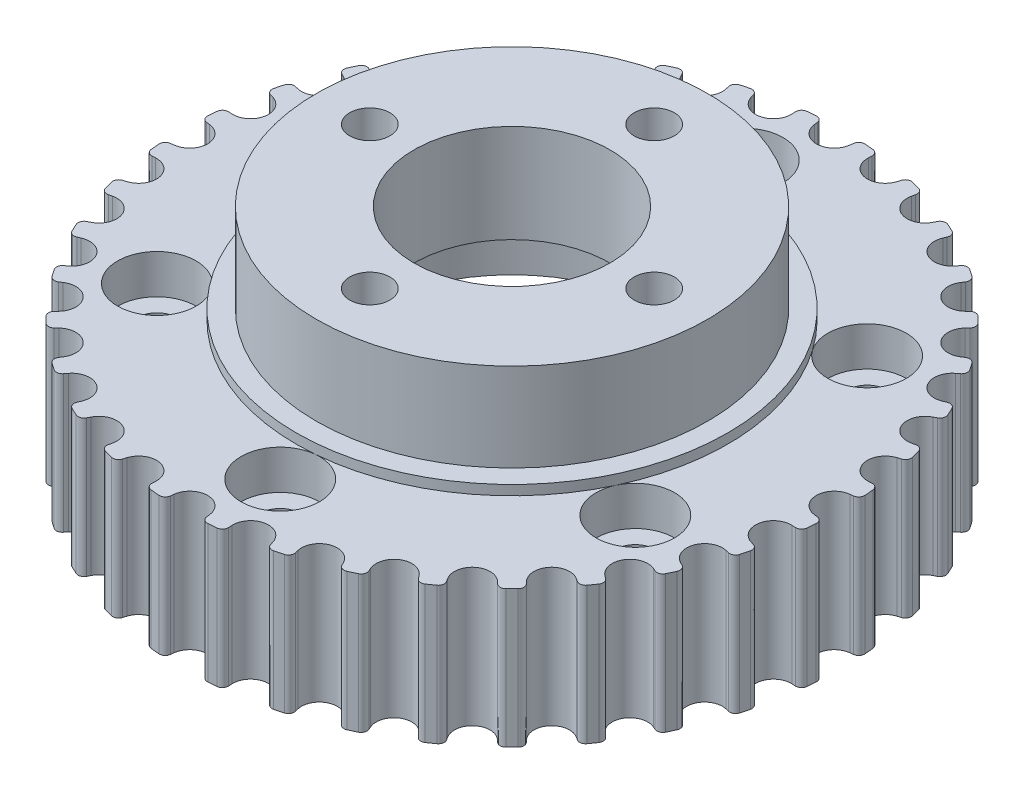
from build123d import *

# Parameters (mm, degrees)
SKETCH_1_R               = 16.8
EXTRUDE_1_DEPTH          = 3.5
CUT_EXTRUDE_1_DEPTH      = 50
PATTERN_CIRCULAR_1_COUNT = 36
SKETCH_4_R               = 7.75
CUT_EXTRUDE_2_DEPTH      = 50
SKETCH_11_R              = 9
CUT_EXTRUDE_9_DEPTH      = 3.5
SKETCH_14_R              = 9.975
SKETCH_14_R_2            = 5
EXTRUDE_3_DEPTH          = 5
SKETCH_15_R              = 1.025
CUT_EXTRUDE_10_DEPTH     = 4
SKETCH_16_R              = 14.5
CUT_EXTRUDE_12_DEPTH     = 3.5
SKETCH_17_R              = 1
CUT_EXTRUDE_13_DEPTH     = 10
SKETCH_20_R              = 2
CUT_EXTRUDE_15_DEPTH     = 2
SKETCH_21_R              = 11
SKETCH_21_R_2            = 9.975
EXTRUDE_4_DEPTH          = 0.5


with BuildPart() as part:
    # 草图1 → 凸台-拉伸1 (new, symmetric)
    with BuildSketch(Plane(origin=(0, 0, 0), x_dir=(1, 0, 0), z_dir=(0, 1, 0))):
        Circle(SKETCH_1_R)
    extrude(amount=EXTRUDE_1_DEPTH, both=True)

    # 草图2 → 切除-拉伸1 (cut, symmetric)
    with BuildSketch(Plane(origin=(0, 0, 0), x_dir=(1, 0, 0), z_dir=(0, 1, 0))):
        with BuildLine():
            Line((-0.903216998, 16.319098898), (-0.924353128, 16.491238864))
            ThreePointArc((-0.924353128, 16.491238864), (-1.031794245, 16.686577305), (-1.244337282, 16.753854026))
            ThreePointArc((-1.244337282, 16.753854026), (0, 16.8), (1.244337282, 16.753854026))
            ThreePointArc((1.244337282, 16.753854026), (1.031794245, 16.686577305), (0.924353128, 16.491238864))
            Line((0.924353128, 16.491238864), (0.903216998, 16.319098898))
            ThreePointArc((0.903216998, 16.319098898), (0, 15.52), (-0.903216998, 16.319098898))
        make_face()
    cut_extrude_1 = extrude(amount=CUT_EXTRUDE_1_DEPTH, both=True, mode=Mode.SUBTRACT)

    # 阵列(圆周)1: 切除-拉伸1 ×36 about axis
    pattern_circular_1_axis = Axis((0, -44, 0), (0, 1, 0))
    for i in range(1, PATTERN_CIRCULAR_1_COUNT):
        add(cut_extrude_1.rotate(pattern_circular_1_axis, i * 360 / PATTERN_CIRCULAR_1_COUNT), mode=Mode.SUBTRACT)

    # 草图4 → 切除-拉伸2 (cut, symmetric)
    with BuildSketch(Plane(origin=(0, 0, 0), x_dir=(1, 0, 0), z_dir=(0, 1, 0))):
        Circle(SKETCH_4_R)
    extrude(amount=CUT_EXTRUDE_2_DEPTH, both=True, mode=Mode.SUBTRACT)

    # 草图11 → 切除-拉伸9 (cut)
    with BuildSketch(Plane.XZ.offset(3.5)):
        Circle(SKETCH_11_R)
    extrude(amount=-CUT_EXTRUDE_9_DEPTH, mode=Mode.SUBTRACT)

    # 草图14 → 凸台-拉伸3 (add)
    with BuildSketch(Plane(origin=(0, 3.5, 0), x_dir=(1, 0, 0), z_dir=(0, 1, 0))):
        Circle(SKETCH_14_R)
        Circle(SKETCH_14_R_2, mode=Mode.SUBTRACT)
    extrude(amount=EXTRUDE_3_DEPTH)

    # 草图15 → 切除-拉伸10 (cut)
    with BuildSketch(Plane(origin=(0, 8.5, 0), x_dir=(1, 0, 0), z_dir=(0, 1, 0))):
        with Locations((0, 7.25)):
            Circle(SKETCH_15_R)
        with Locations((7.25, 0)):
            Circle(SKETCH_15_R)
        with Locations((0, -7.25)):
            Circle(SKETCH_15_R)
        with Locations((-7.25, 0)):
            Circle(SKETCH_15_R)
    extrude(amount=-CUT_EXTRUDE_10_DEPTH, mode=Mode.SUBTRACT)

    # 草图16 → 切除-拉伸12 (cut)
    with BuildSketch(Plane.XZ.offset(3.5)):
        Circle(SKETCH_16_R)
    extrude(amount=-CUT_EXTRUDE_12_DEPTH, mode=Mode.SUBTRACT)

    # 草图17 → 切除-拉伸13 (cut)
    with BuildSketch(Plane(origin=(0, 3.5, 0), x_dir=(1, 0, 0), z_dir=(0, 1, 0))):
        with Locations((-1.133024656, 12.950531075)):
            Circle(SKETCH_17_R)
        with Locations((10.648976576, 7.456493673)):
            Circle(SKETCH_17_R)
        with Locations((11.782001231, -5.494037403)):
            Circle(SKETCH_17_R)
        with Locations((1.133024656, -12.950531075)):
            Circle(SKETCH_17_R)
        with Locations((-10.648976576, -7.456493673)):
            Circle(SKETCH_17_R)
        with Locations((-11.782001231, 5.494037403)):
            Circle(SKETCH_17_R)
    extrude(amount=-CUT_EXTRUDE_13_DEPTH, mode=Mode.SUBTRACT)

    # 草图20 → 切除-拉伸15 (cut)
    with BuildSketch(Plane(origin=(0, 3.5, 0), x_dir=(1, 0, 0), z_dir=(0, 1, 0))):
        with Locations((-11.782001231, 5.494037403)):
            Circle(SKETCH_20_R)
        with Locations((-1.133024656, 12.950531075)):
            Circle(SKETCH_20_R)
        with Locations((10.648976576, 7.456493673)):
            Circle(SKETCH_20_R)
        with Locations((11.782001231, -5.494037403)):
            Circle(SKETCH_20_R)
        with Locations((1.133024656, -12.950531075)):
            Circle(SKETCH_20_R)
        with Locations((-10.648976576, -7.456493673)):
            Circle(SKETCH_20_R)
    extrude(amount=-CUT_EXTRUDE_15_DEPTH, mode=Mode.SUBTRACT)

    # 草图21 → 凸台-拉伸4 (add)
    with BuildSketch(Plane(origin=(0, 3.5, 0), x_dir=(1, 0, 0), z_dir=(0, 1, 0))):
        Circle(SKETCH_21_R)
        Circle(SKETCH_21_R_2, mode=Mode.SUBTRACT)
    extrude(amount=EXTRUDE_4_DEPTH)


solid = part.part
